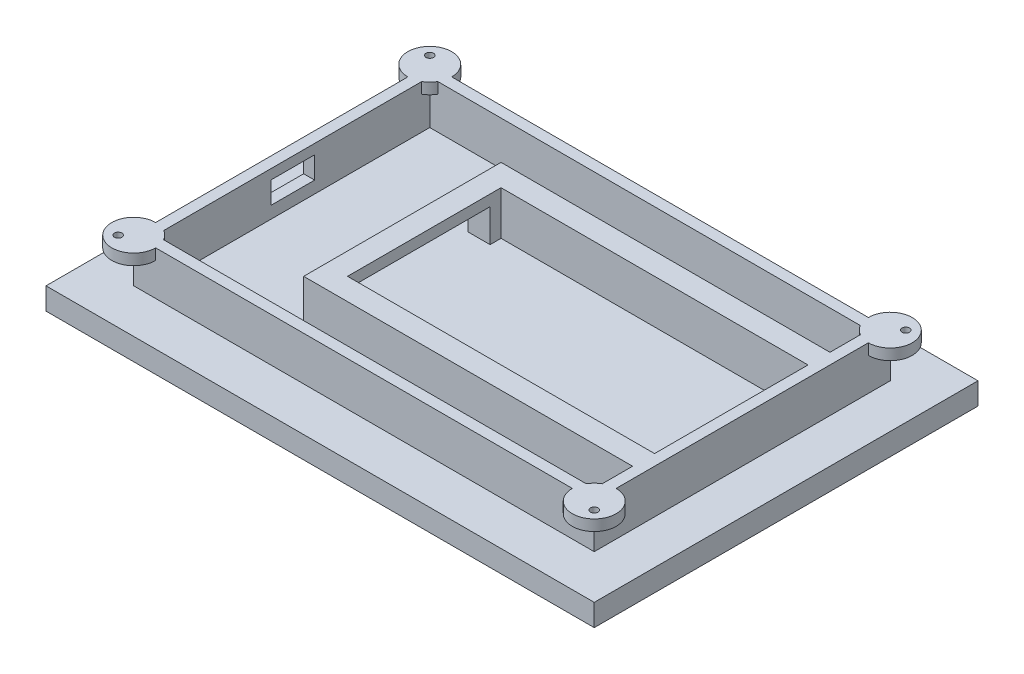
from build123d import *

# Parameters (mm, degrees)
SKETCH1_W           = 200
SKETCH1_H           = 125
BOSS_EXTRUDE3_DEPTH = 40
BOSS_EXTRUDE4_DEPTH = 10
EXTRUDE_THIN1_DEPTH = 40
SKETCH5_W           = 30
SKETCH5_H           = 15
CUT_EXTRUDE2_DEPTH  = 40
SKETCH6_W           = 210
SKETCH6_H           = 135
CUT_EXTRUDE3_DEPTH  = 20
SKETCH7_R           = 10
BOSS_EXTRUDE5_DEPTH = 5
SKETCH8_R           = 1.7
CUT_EXTRUDE5_DEPTH  = 5
SKETCH9_W           = 10
SKETCH9_H           = 5
CUT_EXTRUDE6_DEPTH  = 10
SKETCH10_W          = 230
SKETCH10_H          = 155
BOSS_EXTRUDE6_DEPTH = 10
SKETCH12_W          = 70
SKETCH12_H          = 10
CUT_EXTRUDE7_DEPTH  = 250


with BuildPart() as part:
    # Sketch1 → Boss-Extrude3 (new body)
    with BuildSketch(Plane(origin=(0, 0, 0), x_dir=(1, 0, 0), z_dir=(0, 1, 0))):
        Polygon((5, 0), (0, 0), (0, -135), (210, -135), (210, 0), align=None)
        with Locations((105, -67.5)):
            Rectangle(SKETCH1_W, SKETCH1_H, mode=Mode.SUBTRACT)
    extrude(amount=BOSS_EXTRUDE3_DEPTH)

    # Sketch3 → Boss-Extrude4 (add)
    with BuildSketch(Plane(origin=(0, 0, 0), x_dir=(-1, 0, 0), z_dir=(0, -1, 0))):
        Polygon((-220, -145), (0, -145), (10, -145), (10, 10), (-220, 10), align=None)
    extrude(amount=BOSS_EXTRUDE4_DEPTH)

    # Sketch4 → Extrude-Thin1 (add)
    with BuildSketch(Plane(origin=(0, 0, 0), x_dir=(1, 0, 0), z_dir=(0, 1, 0))):
        Polygon((205, -32.5), (65, -32.5), (65, -102.5), (205, -102.5), (205, -112.5), (55, -112.5), (55, -22.5), (205, -22.5), align=None)
    extrude(amount=EXTRUDE_THIN1_DEPTH)

    # Sketch5 → Cut-Extrude2 (cut)
    with BuildSketch(Plane.ZY.offset(-55)):
        with Locations((82.5, 7.5)):
            Rectangle(SKETCH5_W, SKETCH5_H)
        with Locations((52.5, 7.5)):
            Rectangle(SKETCH5_W, SKETCH5_H)
    extrude(amount=-CUT_EXTRUDE2_DEPTH, mode=Mode.SUBTRACT)

    # Sketch6 → Cut-Extrude3 (cut)
    with BuildSketch(Plane(origin=(0, 40, 0), x_dir=(1, 0, 0), z_dir=(0, 1, 0))):
        with Locations((105, -67.5)):
            Rectangle(SKETCH6_W, SKETCH6_H)
    extrude(amount=-CUT_EXTRUDE3_DEPTH, mode=Mode.SUBTRACT)

    # Sketch7 → Boss-Extrude5 (add)
    with BuildSketch(Plane(origin=(0, 20, 0), x_dir=(1, 0, 0), z_dir=(0, 1, 0))):
        Circle(SKETCH7_R)
        with Locations((210, 0)):
            Circle(SKETCH7_R)
        with Locations((210, -135)):
            Circle(SKETCH7_R)
        with Locations((0, -135)):
            Circle(SKETCH7_R)
    extrude(amount=-BOSS_EXTRUDE5_DEPTH)

    # Sketch8 → Cut-Extrude5 (cut)
    with BuildSketch(Plane(origin=(0, 20, 0), x_dir=(1, 0, 0), z_dir=(0, 1, 0))):
        with Locations(Location((-3.535533906, 3.535533906, 0), (0, 0, 270))):
            Circle(SKETCH8_R)
        with Locations(Location((213.535533906, 3.535533906, 0), (0, 0, 270))):
            Circle(SKETCH8_R)
        with Locations(Location((213.535533906, -138.535533906, 0), (0, 0, 270))):
            Circle(SKETCH8_R)
        with Locations(Location((-3.535533906, -138.535533906, 0), (0, 0, 270))):
            Circle(SKETCH8_R)
    extrude(amount=-CUT_EXTRUDE5_DEPTH, mode=Mode.SUBTRACT)

    # Sketch9 → Cut-Extrude6 (cut)
    with BuildSketch(Plane.ZY):
        Polygon((77.5, 15.5), (77.5, 10.5), (67.5, 10.5), (57.5, 10.5), (57.5, 15.5), align=None)
        with Locations((72.5, 8)):
            Rectangle(SKETCH9_W, SKETCH9_H)
        with Locations((62.5, 8)):
            Rectangle(SKETCH9_W, SKETCH9_H)
    extrude(amount=-CUT_EXTRUDE6_DEPTH, mode=Mode.SUBTRACT)

    # Sketch10 → Boss-Extrude6 (add)
    with BuildSketch(Plane(origin=(0, 0, 0), x_dir=(1, 0, 0), z_dir=(0, 1, 0))):
        Polygon((230, 20), (-10, 20), (-20, 20), (-20, -225), (230, -225), align=None)
        with Locations((105, -67.5)):
            Rectangle(SKETCH10_W, SKETCH10_H, mode=Mode.SUBTRACT)
    extrude(amount=-BOSS_EXTRUDE6_DEPTH)

    # Sketch12 → Cut-Extrude7 (cut)
    with BuildSketch(Plane.ZY.offset(20)):
        with Locations((190, -5)):
            Rectangle(SKETCH12_W, SKETCH12_H)
    extrude(amount=-CUT_EXTRUDE7_DEPTH, mode=Mode.SUBTRACT)


solid = part.part
